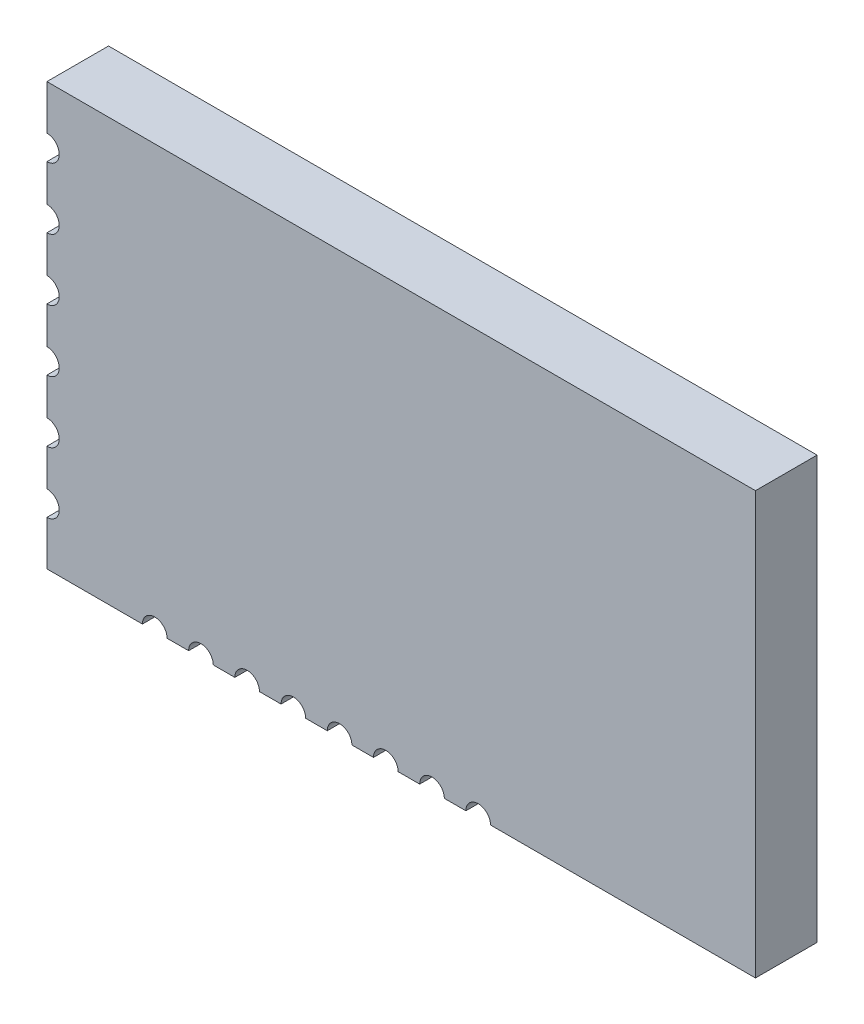
from build123d import *

# Parameters (mm, degrees)
EXTRUDE_1_DEPTH = 2


with BuildPart() as part:
    # Эскиз1 → Бобышка-Вытянуть1 (new body)
    with BuildSketch(Plane(origin=(0, 0, 0), x_dir=(-1, 0, 0), z_dir=(0, 0, -1))):
        with BuildLine():
            Line((-4.023063957, -1.975599526), (-3.323063957, -1.975599526))
            ThreePointArc((-3.323063957, -1.975599526), (-2.923063957, -1.575599526), (-2.523063957, -1.975599526))
            Line((-2.523063957, -1.975599526), (-1.823063957, -1.975599526))
            ThreePointArc((-1.823063957, -1.975599526), (-1.423063957, -1.575599526), (-1.023063957, -1.975599526))
            Line((-1.023063957, -1.975599526), (-0.323063957, -1.975599526))
            ThreePointArc((-0.323063957, -1.975599526), (0.076936043, -1.575599526), (0.476936043, -1.975599526))
            Line((0.476936043, -1.975599526), (1.176936043, -1.975599526))
            ThreePointArc((1.176936043, -1.975599526), (1.576936043, -1.575599526), (1.976936043, -1.975599526))
            Line((1.976936043, -1.975599526), (2.676936043, -1.975599526))
            ThreePointArc((2.676936043, -1.975599526), (3.076936043, -1.575599526), (3.476936043, -1.975599526))
            Line((3.476936043, -1.975599526), (4.176936043, -1.975599526))
            ThreePointArc((4.176936043, -1.975599526), (4.576936043, -1.575599526), (4.976936043, -1.975599526))
            Line((4.976936043, -1.975599526), (5.676936043, -1.975599526))
            ThreePointArc((5.676936043, -1.975599526), (6.076936043, -1.575599526), (6.476936043, -1.975599526))
            Line((6.476936043, -1.975599526), (9.576936043, -1.975599526))
            Line((9.576936043, -1.975599526), (9.576936043, -0.525599526))
            ThreePointArc((9.576936043, -0.525599526), (9.176936043, -0.125599526), (9.576936043, 0.274400474))
            Line((9.576936043, 0.274400474), (9.576936043, 1.474400474))
            ThreePointArc((9.576936043, 1.474400474), (9.176936043, 1.874400474), (9.576936043, 2.274400474))
            Line((9.576936043, 2.274400474), (9.576936043, 3.474400474))
            ThreePointArc((9.576936043, 3.474400474), (9.176936043, 3.874400474), (9.576936043, 4.274400474))
            Line((9.576936043, 4.274400474), (9.576936043, 5.474400474))
            ThreePointArc((9.576936043, 5.474400474), (9.176936043, 5.874400474), (9.576936043, 6.274400474))
            Line((9.576936043, 6.274400474), (9.576936043, 7.474400474))
            ThreePointArc((9.576936043, 7.474400474), (9.176936043, 7.874400474), (9.576936043, 8.274400474))
            Line((9.576936043, 8.274400474), (9.576936043, 9.474400474))
            ThreePointArc((9.576936043, 9.474400474), (9.176936043, 9.874400474), (9.576936043, 10.274400474))
            Line((9.576936043, 10.274400474), (9.576936043, 11.724400474))
            Line((9.576936043, 11.724400474), (-13.423063957, 11.724400474))
            Line((-13.423063957, 11.724400474), (-13.423063957, -1.975599526))
            Line((-13.423063957, -1.975599526), (-4.823063957, -1.975599526))
            ThreePointArc((-4.823063957, -1.975599526), (-4.423063957, -1.575599526), (-4.023063957, -1.975599526))
        make_face()
    extrude(amount=EXTRUDE_1_DEPTH)


solid = part.part
